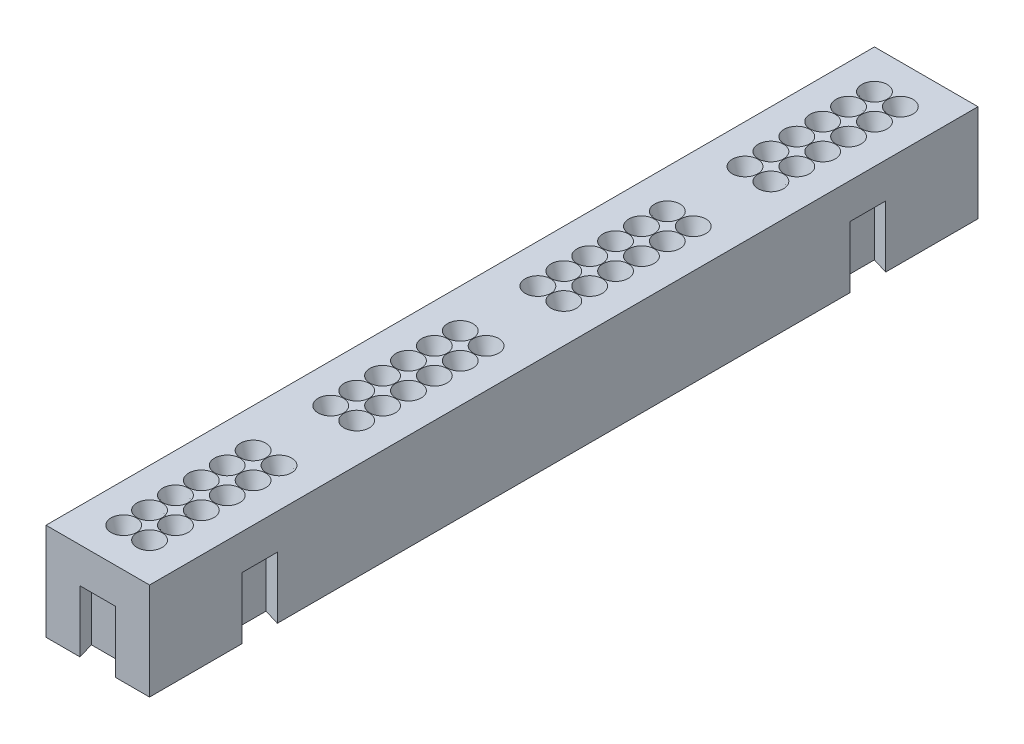
from build123d import *

# Parameters (mm, degrees)
SKETCH1_W                     = 10.16
SKETCH1_H                     = 81.28
EXTRUDE1_DEPTH                = 9.525
EXTRUDE3_DEPTH                = 6.0452
EXTRUDE4_DEPTH                = 5.08
HOLE1_D                       = 0.762
HOLE1_DEPTH                   = 8.382
HOLE1_CSINK_D                 = 2.4892
HOLE1_CSINK_ANGLE             = 40
LPATTERN2_COUNT               = 2
LPATTERN2_PITCH               = 2.54
LPATTERN2_COUNT_DIR2          = 6
LPATTERN2_PITCH_DIR2          = 2.54
LPATTERN3_COUNT               = 4
LPATTERN3_PITCH               = 20.32
LPATTERN3_COPY_1_D            = 0.762
LPATTERN3_COPY_1_DEPTH        = 8.382
LPATTERN3_COPY_1_CSINK_D      = 2.4892
LPATTERN3_COPY_1_CSINK_ANGLE  = 40
LPATTERN3_COPY_2_D            = 0.762
LPATTERN3_COPY_2_DEPTH        = 8.382
LPATTERN3_COPY_2_CSINK_D      = 2.4892
LPATTERN3_COPY_2_CSINK_ANGLE  = 40
LPATTERN3_COPY_3_D            = 0.762
LPATTERN3_COPY_3_DEPTH        = 8.382
LPATTERN3_COPY_3_CSINK_D      = 2.4892
LPATTERN3_COPY_3_CSINK_ANGLE  = 40
LPATTERN3_COPY_4_D            = 0.762
LPATTERN3_COPY_4_DEPTH        = 8.382
LPATTERN3_COPY_4_CSINK_D      = 2.4892
LPATTERN3_COPY_4_CSINK_ANGLE  = 40
LPATTERN3_COPY_5_D            = 0.762
LPATTERN3_COPY_5_DEPTH        = 8.382
LPATTERN3_COPY_5_CSINK_D      = 2.4892
LPATTERN3_COPY_5_CSINK_ANGLE  = 40
LPATTERN3_COPY_6_D            = 0.762
LPATTERN3_COPY_6_DEPTH        = 8.382
LPATTERN3_COPY_6_CSINK_D      = 2.4892
LPATTERN3_COPY_6_CSINK_ANGLE  = 40
LPATTERN3_COPY_7_D            = 0.762
LPATTERN3_COPY_7_DEPTH        = 8.382
LPATTERN3_COPY_7_CSINK_D      = 2.4892
LPATTERN3_COPY_7_CSINK_ANGLE  = 40
LPATTERN3_COPY_8_D            = 0.762
LPATTERN3_COPY_8_DEPTH        = 8.382
LPATTERN3_COPY_8_CSINK_D      = 2.4892
LPATTERN3_COPY_8_CSINK_ANGLE  = 40
LPATTERN3_COPY_9_D            = 0.762
LPATTERN3_COPY_9_DEPTH        = 8.382
LPATTERN3_COPY_9_CSINK_D      = 2.4892
LPATTERN3_COPY_9_CSINK_ANGLE  = 40
LPATTERN3_COPY_10_D           = 0.762
LPATTERN3_COPY_10_DEPTH       = 8.382
LPATTERN3_COPY_10_CSINK_D     = 2.4892
LPATTERN3_COPY_10_CSINK_ANGLE = 40
LPATTERN3_COPY_11_D           = 0.762
LPATTERN3_COPY_11_DEPTH       = 8.382
LPATTERN3_COPY_11_CSINK_D     = 2.4892
LPATTERN3_COPY_11_CSINK_ANGLE = 40
LPATTERN3_COPY_12_D           = 0.762
LPATTERN3_COPY_12_DEPTH       = 8.382
LPATTERN3_COPY_12_CSINK_D     = 2.4892
LPATTERN3_COPY_12_CSINK_ANGLE = 40
LPATTERN3_COPY_13_D           = 0.762
LPATTERN3_COPY_13_DEPTH       = 8.382
LPATTERN3_COPY_13_CSINK_D     = 2.4892
LPATTERN3_COPY_13_CSINK_ANGLE = 40
LPATTERN3_COPY_14_D           = 0.762
LPATTERN3_COPY_14_DEPTH       = 8.382
LPATTERN3_COPY_14_CSINK_D     = 2.4892
LPATTERN3_COPY_14_CSINK_ANGLE = 40
LPATTERN3_COPY_15_D           = 0.762
LPATTERN3_COPY_15_DEPTH       = 8.382
LPATTERN3_COPY_15_CSINK_D     = 2.4892
LPATTERN3_COPY_15_CSINK_ANGLE = 40
LPATTERN3_COPY_16_D           = 0.762
LPATTERN3_COPY_16_DEPTH       = 8.382
LPATTERN3_COPY_16_CSINK_D     = 2.4892
LPATTERN3_COPY_16_CSINK_ANGLE = 40
LPATTERN3_COPY_17_D           = 0.762
LPATTERN3_COPY_17_DEPTH       = 8.382
LPATTERN3_COPY_17_CSINK_D     = 2.4892
LPATTERN3_COPY_17_CSINK_ANGLE = 40
LPATTERN3_COPY_18_D           = 0.762
LPATTERN3_COPY_18_DEPTH       = 8.382
LPATTERN3_COPY_18_CSINK_D     = 2.4892
LPATTERN3_COPY_18_CSINK_ANGLE = 40
LPATTERN3_COPY_19_D           = 0.762
LPATTERN3_COPY_19_DEPTH       = 8.382
LPATTERN3_COPY_19_CSINK_D     = 2.4892
LPATTERN3_COPY_19_CSINK_ANGLE = 40
LPATTERN3_COPY_20_D           = 0.762
LPATTERN3_COPY_20_DEPTH       = 8.382
LPATTERN3_COPY_20_CSINK_D     = 2.4892
LPATTERN3_COPY_20_CSINK_ANGLE = 40
LPATTERN3_COPY_21_D           = 0.762
LPATTERN3_COPY_21_DEPTH       = 8.382
LPATTERN3_COPY_21_CSINK_D     = 2.4892
LPATTERN3_COPY_21_CSINK_ANGLE = 40
LPATTERN3_COPY_22_D           = 0.762
LPATTERN3_COPY_22_DEPTH       = 8.382
LPATTERN3_COPY_22_CSINK_D     = 2.4892
LPATTERN3_COPY_22_CSINK_ANGLE = 40
LPATTERN3_COPY_23_D           = 0.762
LPATTERN3_COPY_23_DEPTH       = 8.382
LPATTERN3_COPY_23_CSINK_D     = 2.4892
LPATTERN3_COPY_23_CSINK_ANGLE = 40
LPATTERN3_COPY_24_D           = 0.762
LPATTERN3_COPY_24_DEPTH       = 8.382
LPATTERN3_COPY_24_CSINK_D     = 2.4892
LPATTERN3_COPY_24_CSINK_ANGLE = 40
LPATTERN3_COPY_25_D           = 0.762
LPATTERN3_COPY_25_DEPTH       = 8.382
LPATTERN3_COPY_25_CSINK_D     = 2.4892
LPATTERN3_COPY_25_CSINK_ANGLE = 40
LPATTERN3_COPY_26_D           = 0.762
LPATTERN3_COPY_26_DEPTH       = 8.382
LPATTERN3_COPY_26_CSINK_D     = 2.4892
LPATTERN3_COPY_26_CSINK_ANGLE = 40
LPATTERN3_COPY_27_D           = 0.762
LPATTERN3_COPY_27_DEPTH       = 8.382
LPATTERN3_COPY_27_CSINK_D     = 2.4892
LPATTERN3_COPY_27_CSINK_ANGLE = 40
LPATTERN3_COPY_28_D           = 0.762
LPATTERN3_COPY_28_DEPTH       = 8.382
LPATTERN3_COPY_28_CSINK_D     = 2.4892
LPATTERN3_COPY_28_CSINK_ANGLE = 40
LPATTERN3_COPY_29_D           = 0.762
LPATTERN3_COPY_29_DEPTH       = 8.382
LPATTERN3_COPY_29_CSINK_D     = 2.4892
LPATTERN3_COPY_29_CSINK_ANGLE = 40
LPATTERN3_COPY_30_D           = 0.762
LPATTERN3_COPY_30_DEPTH       = 8.382
LPATTERN3_COPY_30_CSINK_D     = 2.4892
LPATTERN3_COPY_30_CSINK_ANGLE = 40
LPATTERN3_COPY_31_D           = 0.762
LPATTERN3_COPY_31_DEPTH       = 8.382
LPATTERN3_COPY_31_CSINK_D     = 2.4892
LPATTERN3_COPY_31_CSINK_ANGLE = 40
LPATTERN3_COPY_32_D           = 0.762
LPATTERN3_COPY_32_DEPTH       = 8.382
LPATTERN3_COPY_32_CSINK_D     = 2.4892
LPATTERN3_COPY_32_CSINK_ANGLE = 40
LPATTERN3_COPY_33_D           = 0.762
LPATTERN3_COPY_33_DEPTH       = 8.382
LPATTERN3_COPY_33_CSINK_D     = 2.4892
LPATTERN3_COPY_33_CSINK_ANGLE = 40


with BuildPart() as part:
    # Sketch1 → Extrude1 (new body)
    with BuildSketch(Plane(origin=(0, 0, 0), x_dir=(1, 0, 0), z_dir=(0, 1, 0))):
        Rectangle(SKETCH1_W, SKETCH1_H)
    extrude(amount=EXTRUDE1_DEPTH)

    # Sketch3 → Extrude3 (cut)
    with BuildSketch(Plane.XZ):
        Polygon((5.08, -31.5849), (3.4925, -32.0675), (3.4925, -27.6225), (5.08, -28.1051), align=None)
        Polygon((5.08, 28.1051), (3.4925, 27.6225), (3.4925, 32.0675), (5.08, 31.5849), align=None)
        Polygon((1.7399, 40.64), (-1.7399, 40.64), (-2.2225, 39.0525), (2.2225, 39.0525), align=None)
    extrude(amount=-EXTRUDE3_DEPTH, mode=Mode.SUBTRACT)

    # Sketch5 → Extrude4 (add)
    with BuildSketch(Plane.XZ.offset(-6.0452)):
        Polygon((-5.08, -31.5849), (-6.6675, -32.0675), (-6.6675, -27.6225), (-5.08, -28.1051), align=None)
        Polygon((-5.08, 28.1051), (-6.6675, 27.6225), (-6.6675, 32.0675), (-5.08, 31.5849), align=None)
        Polygon((1.7399, -40.64), (-1.7399, -40.64), (-2.2225, -42.2275), (2.2225, -42.2275), align=None)
    extrude(amount=EXTRUDE4_DEPTH)

    # Hole1
    with Locations(Plane(origin=(0, 9.525, 0), x_dir=(-1, 0, 0), z_dir=(0, 1, 0))):
        with Locations((1.27, 36.83)):
            hole1 = CounterSinkHole(HOLE1_D / 2, HOLE1_CSINK_D / 2, depth=HOLE1_DEPTH, counter_sink_angle=HOLE1_CSINK_ANGLE)

    # LPattern2: Hole1 2 × 6
    with Locations(*[(i * LPATTERN2_PITCH, 0, -j * LPATTERN2_PITCH_DIR2) for i in range(LPATTERN2_COUNT) for j in range(LPATTERN2_COUNT_DIR2) if (i, j) != (0, 0)]):
        add(hole1, mode=Mode.SUBTRACT)

    # LPattern3: Hole1 ×4
    with Locations(*[(0, 0, -i * LPATTERN3_PITCH) for i in range(1, LPATTERN3_COUNT)]):
        add(hole1, mode=Mode.SUBTRACT)

    # LPattern3 copy 1
    with Locations(Plane(origin=(0, 9.525, -22.86), x_dir=(-1, 0, 0), z_dir=(0, 1, 0))):
        with Locations((1.27, 36.83)):
            CounterSinkHole(LPATTERN3_COPY_1_D / 2, LPATTERN3_COPY_1_CSINK_D / 2, depth=LPATTERN3_COPY_1_DEPTH, counter_sink_angle=LPATTERN3_COPY_1_CSINK_ANGLE)

    # LPattern3 copy 2
    with Locations(Plane(origin=(0, 9.525, -43.18), x_dir=(-1, 0, 0), z_dir=(0, 1, 0))):
        with Locations((1.27, 36.83)):
            CounterSinkHole(LPATTERN3_COPY_2_D / 2, LPATTERN3_COPY_2_CSINK_D / 2, depth=LPATTERN3_COPY_2_DEPTH, counter_sink_angle=LPATTERN3_COPY_2_CSINK_ANGLE)

    # LPattern3 copy 3
    with Locations(Plane(origin=(0, 9.525, -63.5), x_dir=(-1, 0, 0), z_dir=(0, 1, 0))):
        with Locations((1.27, 36.83)):
            CounterSinkHole(LPATTERN3_COPY_3_D / 2, LPATTERN3_COPY_3_CSINK_D / 2, depth=LPATTERN3_COPY_3_DEPTH, counter_sink_angle=LPATTERN3_COPY_3_CSINK_ANGLE)

    # LPattern3 copy 4
    with Locations(Plane(origin=(0, 9.525, -25.4), x_dir=(-1, 0, 0), z_dir=(0, 1, 0))):
        with Locations((1.27, 36.83)):
            CounterSinkHole(LPATTERN3_COPY_4_D / 2, LPATTERN3_COPY_4_CSINK_D / 2, depth=LPATTERN3_COPY_4_DEPTH, counter_sink_angle=LPATTERN3_COPY_4_CSINK_ANGLE)

    # LPattern3 copy 5
    with Locations(Plane(origin=(0, 9.525, -45.72), x_dir=(-1, 0, 0), z_dir=(0, 1, 0))):
        with Locations((1.27, 36.83)):
            CounterSinkHole(LPATTERN3_COPY_5_D / 2, LPATTERN3_COPY_5_CSINK_D / 2, depth=LPATTERN3_COPY_5_DEPTH, counter_sink_angle=LPATTERN3_COPY_5_CSINK_ANGLE)

    # LPattern3 copy 6
    with Locations(Plane(origin=(0, 9.525, -66.04), x_dir=(-1, 0, 0), z_dir=(0, 1, 0))):
        with Locations((1.27, 36.83)):
            CounterSinkHole(LPATTERN3_COPY_6_D / 2, LPATTERN3_COPY_6_CSINK_D / 2, depth=LPATTERN3_COPY_6_DEPTH, counter_sink_angle=LPATTERN3_COPY_6_CSINK_ANGLE)

    # LPattern3 copy 7
    with Locations(Plane(origin=(0, 9.525, -27.94), x_dir=(-1, 0, 0), z_dir=(0, 1, 0))):
        with Locations((1.27, 36.83)):
            CounterSinkHole(LPATTERN3_COPY_7_D / 2, LPATTERN3_COPY_7_CSINK_D / 2, depth=LPATTERN3_COPY_7_DEPTH, counter_sink_angle=LPATTERN3_COPY_7_CSINK_ANGLE)

    # LPattern3 copy 8
    with Locations(Plane(origin=(0, 9.525, -48.26), x_dir=(-1, 0, 0), z_dir=(0, 1, 0))):
        with Locations((1.27, 36.83)):
            CounterSinkHole(LPATTERN3_COPY_8_D / 2, LPATTERN3_COPY_8_CSINK_D / 2, depth=LPATTERN3_COPY_8_DEPTH, counter_sink_angle=LPATTERN3_COPY_8_CSINK_ANGLE)

    # LPattern3 copy 9
    with Locations(Plane(origin=(0, 9.525, -68.58), x_dir=(-1, 0, 0), z_dir=(0, 1, 0))):
        with Locations((1.27, 36.83)):
            CounterSinkHole(LPATTERN3_COPY_9_D / 2, LPATTERN3_COPY_9_CSINK_D / 2, depth=LPATTERN3_COPY_9_DEPTH, counter_sink_angle=LPATTERN3_COPY_9_CSINK_ANGLE)

    # LPattern3 copy 10
    with Locations(Plane(origin=(0, 9.525, -30.48), x_dir=(-1, 0, 0), z_dir=(0, 1, 0))):
        with Locations((1.27, 36.83)):
            CounterSinkHole(LPATTERN3_COPY_10_D / 2, LPATTERN3_COPY_10_CSINK_D / 2, depth=LPATTERN3_COPY_10_DEPTH, counter_sink_angle=LPATTERN3_COPY_10_CSINK_ANGLE)

    # LPattern3 copy 11
    with Locations(Plane(origin=(0, 9.525, -50.8), x_dir=(-1, 0, 0), z_dir=(0, 1, 0))):
        with Locations((1.27, 36.83)):
            CounterSinkHole(LPATTERN3_COPY_11_D / 2, LPATTERN3_COPY_11_CSINK_D / 2, depth=LPATTERN3_COPY_11_DEPTH, counter_sink_angle=LPATTERN3_COPY_11_CSINK_ANGLE)

    # LPattern3 copy 12
    with Locations(Plane(origin=(0, 9.525, -71.12), x_dir=(-1, 0, 0), z_dir=(0, 1, 0))):
        with Locations((1.27, 36.83)):
            CounterSinkHole(LPATTERN3_COPY_12_D / 2, LPATTERN3_COPY_12_CSINK_D / 2, depth=LPATTERN3_COPY_12_DEPTH, counter_sink_angle=LPATTERN3_COPY_12_CSINK_ANGLE)

    # LPattern3 copy 13
    with Locations(Plane(origin=(0, 9.525, -33.02), x_dir=(-1, 0, 0), z_dir=(0, 1, 0))):
        with Locations((1.27, 36.83)):
            CounterSinkHole(LPATTERN3_COPY_13_D / 2, LPATTERN3_COPY_13_CSINK_D / 2, depth=LPATTERN3_COPY_13_DEPTH, counter_sink_angle=LPATTERN3_COPY_13_CSINK_ANGLE)

    # LPattern3 copy 14
    with Locations(Plane(origin=(0, 9.525, -53.34), x_dir=(-1, 0, 0), z_dir=(0, 1, 0))):
        with Locations((1.27, 36.83)):
            CounterSinkHole(LPATTERN3_COPY_14_D / 2, LPATTERN3_COPY_14_CSINK_D / 2, depth=LPATTERN3_COPY_14_DEPTH, counter_sink_angle=LPATTERN3_COPY_14_CSINK_ANGLE)

    # LPattern3 copy 15
    with Locations(Plane(origin=(0, 9.525, -73.66), x_dir=(-1, 0, 0), z_dir=(0, 1, 0))):
        with Locations((1.27, 36.83)):
            CounterSinkHole(LPATTERN3_COPY_15_D / 2, LPATTERN3_COPY_15_CSINK_D / 2, depth=LPATTERN3_COPY_15_DEPTH, counter_sink_angle=LPATTERN3_COPY_15_CSINK_ANGLE)

    # LPattern3 copy 16
    with Locations(Plane(origin=(2.54, 9.525, -20.32), x_dir=(-1, 0, 0), z_dir=(0, 1, 0))):
        with Locations((1.27, 36.83)):
            CounterSinkHole(LPATTERN3_COPY_16_D / 2, LPATTERN3_COPY_16_CSINK_D / 2, depth=LPATTERN3_COPY_16_DEPTH, counter_sink_angle=LPATTERN3_COPY_16_CSINK_ANGLE)

    # LPattern3 copy 17
    with Locations(Plane(origin=(2.54, 9.525, -40.64), x_dir=(-1, 0, 0), z_dir=(0, 1, 0))):
        with Locations((1.27, 36.83)):
            CounterSinkHole(LPATTERN3_COPY_17_D / 2, LPATTERN3_COPY_17_CSINK_D / 2, depth=LPATTERN3_COPY_17_DEPTH, counter_sink_angle=LPATTERN3_COPY_17_CSINK_ANGLE)

    # LPattern3 copy 18
    with Locations(Plane(origin=(2.54, 9.525, -60.96), x_dir=(-1, 0, 0), z_dir=(0, 1, 0))):
        with Locations((1.27, 36.83)):
            CounterSinkHole(LPATTERN3_COPY_18_D / 2, LPATTERN3_COPY_18_CSINK_D / 2, depth=LPATTERN3_COPY_18_DEPTH, counter_sink_angle=LPATTERN3_COPY_18_CSINK_ANGLE)

    # LPattern3 copy 19
    with Locations(Plane(origin=(2.54, 9.525, -22.86), x_dir=(-1, 0, 0), z_dir=(0, 1, 0))):
        with Locations((1.27, 36.83)):
            CounterSinkHole(LPATTERN3_COPY_19_D / 2, LPATTERN3_COPY_19_CSINK_D / 2, depth=LPATTERN3_COPY_19_DEPTH, counter_sink_angle=LPATTERN3_COPY_19_CSINK_ANGLE)

    # LPattern3 copy 20
    with Locations(Plane(origin=(2.54, 9.525, -43.18), x_dir=(-1, 0, 0), z_dir=(0, 1, 0))):
        with Locations((1.27, 36.83)):
            CounterSinkHole(LPATTERN3_COPY_20_D / 2, LPATTERN3_COPY_20_CSINK_D / 2, depth=LPATTERN3_COPY_20_DEPTH, counter_sink_angle=LPATTERN3_COPY_20_CSINK_ANGLE)

    # LPattern3 copy 21
    with Locations(Plane(origin=(2.54, 9.525, -63.5), x_dir=(-1, 0, 0), z_dir=(0, 1, 0))):
        with Locations((1.27, 36.83)):
            CounterSinkHole(LPATTERN3_COPY_21_D / 2, LPATTERN3_COPY_21_CSINK_D / 2, depth=LPATTERN3_COPY_21_DEPTH, counter_sink_angle=LPATTERN3_COPY_21_CSINK_ANGLE)

    # LPattern3 copy 22
    with Locations(Plane(origin=(2.54, 9.525, -25.4), x_dir=(-1, 0, 0), z_dir=(0, 1, 0))):
        with Locations((1.27, 36.83)):
            CounterSinkHole(LPATTERN3_COPY_22_D / 2, LPATTERN3_COPY_22_CSINK_D / 2, depth=LPATTERN3_COPY_22_DEPTH, counter_sink_angle=LPATTERN3_COPY_22_CSINK_ANGLE)

    # LPattern3 copy 23
    with Locations(Plane(origin=(2.54, 9.525, -45.72), x_dir=(-1, 0, 0), z_dir=(0, 1, 0))):
        with Locations((1.27, 36.83)):
            CounterSinkHole(LPATTERN3_COPY_23_D / 2, LPATTERN3_COPY_23_CSINK_D / 2, depth=LPATTERN3_COPY_23_DEPTH, counter_sink_angle=LPATTERN3_COPY_23_CSINK_ANGLE)

    # LPattern3 copy 24
    with Locations(Plane(origin=(2.54, 9.525, -66.04), x_dir=(-1, 0, 0), z_dir=(0, 1, 0))):
        with Locations((1.27, 36.83)):
            CounterSinkHole(LPATTERN3_COPY_24_D / 2, LPATTERN3_COPY_24_CSINK_D / 2, depth=LPATTERN3_COPY_24_DEPTH, counter_sink_angle=LPATTERN3_COPY_24_CSINK_ANGLE)

    # LPattern3 copy 25
    with Locations(Plane(origin=(2.54, 9.525, -27.94), x_dir=(-1, 0, 0), z_dir=(0, 1, 0))):
        with Locations((1.27, 36.83)):
            CounterSinkHole(LPATTERN3_COPY_25_D / 2, LPATTERN3_COPY_25_CSINK_D / 2, depth=LPATTERN3_COPY_25_DEPTH, counter_sink_angle=LPATTERN3_COPY_25_CSINK_ANGLE)

    # LPattern3 copy 26
    with Locations(Plane(origin=(2.54, 9.525, -48.26), x_dir=(-1, 0, 0), z_dir=(0, 1, 0))):
        with Locations((1.27, 36.83)):
            CounterSinkHole(LPATTERN3_COPY_26_D / 2, LPATTERN3_COPY_26_CSINK_D / 2, depth=LPATTERN3_COPY_26_DEPTH, counter_sink_angle=LPATTERN3_COPY_26_CSINK_ANGLE)

    # LPattern3 copy 27
    with Locations(Plane(origin=(2.54, 9.525, -68.58), x_dir=(-1, 0, 0), z_dir=(0, 1, 0))):
        with Locations((1.27, 36.83)):
            CounterSinkHole(LPATTERN3_COPY_27_D / 2, LPATTERN3_COPY_27_CSINK_D / 2, depth=LPATTERN3_COPY_27_DEPTH, counter_sink_angle=LPATTERN3_COPY_27_CSINK_ANGLE)

    # LPattern3 copy 28
    with Locations(Plane(origin=(2.54, 9.525, -30.48), x_dir=(-1, 0, 0), z_dir=(0, 1, 0))):
        with Locations((1.27, 36.83)):
            CounterSinkHole(LPATTERN3_COPY_28_D / 2, LPATTERN3_COPY_28_CSINK_D / 2, depth=LPATTERN3_COPY_28_DEPTH, counter_sink_angle=LPATTERN3_COPY_28_CSINK_ANGLE)

    # LPattern3 copy 29
    with Locations(Plane(origin=(2.54, 9.525, -50.8), x_dir=(-1, 0, 0), z_dir=(0, 1, 0))):
        with Locations((1.27, 36.83)):
            CounterSinkHole(LPATTERN3_COPY_29_D / 2, LPATTERN3_COPY_29_CSINK_D / 2, depth=LPATTERN3_COPY_29_DEPTH, counter_sink_angle=LPATTERN3_COPY_29_CSINK_ANGLE)

    # LPattern3 copy 30
    with Locations(Plane(origin=(2.54, 9.525, -71.12), x_dir=(-1, 0, 0), z_dir=(0, 1, 0))):
        with Locations((1.27, 36.83)):
            CounterSinkHole(LPATTERN3_COPY_30_D / 2, LPATTERN3_COPY_30_CSINK_D / 2, depth=LPATTERN3_COPY_30_DEPTH, counter_sink_angle=LPATTERN3_COPY_30_CSINK_ANGLE)

    # LPattern3 copy 31
    with Locations(Plane(origin=(2.54, 9.525, -33.02), x_dir=(-1, 0, 0), z_dir=(0, 1, 0))):
        with Locations((1.27, 36.83)):
            CounterSinkHole(LPATTERN3_COPY_31_D / 2, LPATTERN3_COPY_31_CSINK_D / 2, depth=LPATTERN3_COPY_31_DEPTH, counter_sink_angle=LPATTERN3_COPY_31_CSINK_ANGLE)

    # LPattern3 copy 32
    with Locations(Plane(origin=(2.54, 9.525, -53.34), x_dir=(-1, 0, 0), z_dir=(0, 1, 0))):
        with Locations((1.27, 36.83)):
            CounterSinkHole(LPATTERN3_COPY_32_D / 2, LPATTERN3_COPY_32_CSINK_D / 2, depth=LPATTERN3_COPY_32_DEPTH, counter_sink_angle=LPATTERN3_COPY_32_CSINK_ANGLE)

    # LPattern3 copy 33
    with Locations(Plane(origin=(2.54, 9.525, -73.66), x_dir=(-1, 0, 0), z_dir=(0, 1, 0))):
        with Locations((1.27, 36.83)):
            CounterSinkHole(LPATTERN3_COPY_33_D / 2, LPATTERN3_COPY_33_CSINK_D / 2, depth=LPATTERN3_COPY_33_DEPTH, counter_sink_angle=LPATTERN3_COPY_33_CSINK_ANGLE)


solid = part.part
